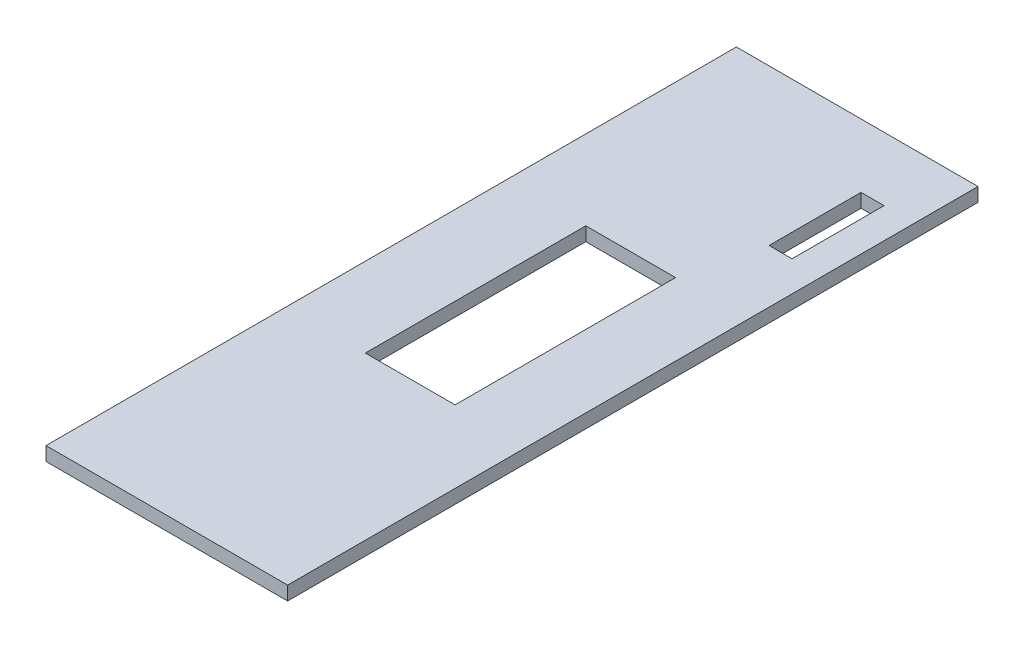
from build123d import *

# Parameters (mm, degrees)
SKETCH1_W           = 105
SKETCH1_H           = 6
BOSS_EXTRUDE1_DEPTH = 300
SKETCH2_W           = 10
SKETCH2_H           = 40
CUT_EXTRUDE1_DEPTH  = 10
SKETCH3_W           = 39
SKETCH3_H           = 95.8
CUT_EXTRUDE2_DEPTH  = 10


with BuildPart() as part:
    # Sketch1 → Boss-Extrude1 (new body)
    with BuildSketch(Plane.XY):
        with Locations((22.309725159, 5.768498943)):
            Rectangle(SKETCH1_W, SKETCH1_H)
    extrude(amount=BOSS_EXTRUDE1_DEPTH)

    # Sketch2 → Cut-Extrude1 (cut)
    with BuildSketch(Plane(origin=(0, 8.768498943, 0), x_dir=(1, 0, 0), z_dir=(0, 1, 0))):
        with Locations((56.609725159, -47.62)):
            Rectangle(SKETCH2_W, SKETCH2_H)
    extrude(amount=-CUT_EXTRUDE1_DEPTH, mode=Mode.SUBTRACT)

    # Sketch3 → Cut-Extrude2 (cut)
    with BuildSketch(Plane(origin=(0, 8.768498943, 0), x_dir=(1, 0, 0), z_dir=(0, 1, 0))):
        with Locations((23.879725159, -147.9)):
            Rectangle(SKETCH3_W, SKETCH3_H)
    extrude(amount=-CUT_EXTRUDE2_DEPTH, mode=Mode.SUBTRACT)


solid = part.part
